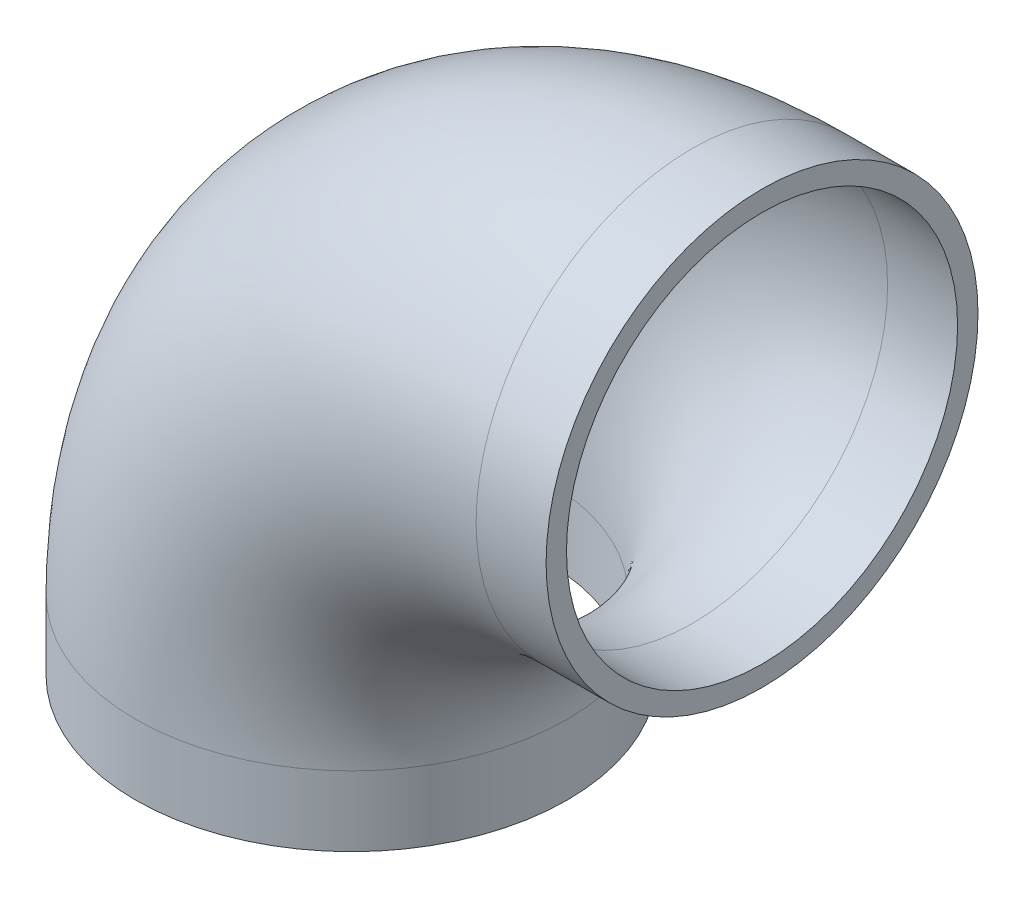
from build123d import *

# Parameters (mm, degrees)
CROQUIS3_R   = 84.15
CROQUIS3_R_2 = 76.2


with BuildPart() as part:
    # Barrer1: sweep along a path in Croquis2
    with BuildLine(Plane.XY) as barrer1_path:
        Line((0, 0), (0, 27.27))
        ThreePointArc((0, 27.27), (38.875716933, 121.124283067), (132.73, 160))
        Line((132.73, 160), (160, 160))
    # Croquis3 → Barrer1 (sweep)
    with BuildSketch(Plane(origin=(0, 0, 0), x_dir=(1, 0, 0), z_dir=(0, 1, 0))):
        Circle(CROQUIS3_R)
        Circle(CROQUIS3_R_2, mode=Mode.SUBTRACT)
    sweep(path=barrer1_path.line)


solid = part.part
